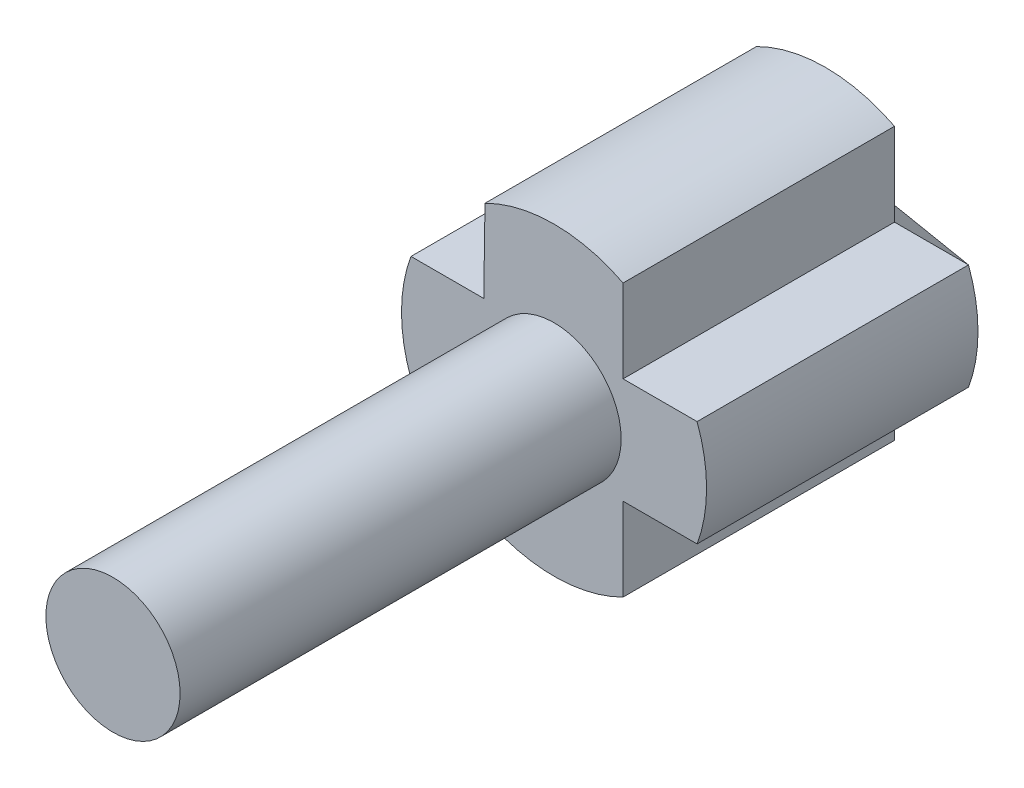
from build123d import *

# Parameters (mm, degrees)
SKETCH_1_R      = 19.783013461
EXTRUDE_1_DEPTH = 130
EXTRUDE_2_DEPTH = 80


with BuildPart() as part:
    # 草图1 → 凸台-拉伸1 (new body)
    with BuildSketch(Plane.XY):
        Circle(SKETCH_1_R)
    extrude(amount=EXTRUDE_1_DEPTH)

    # 草图2 → 凸台-拉伸2 (add)
    with BuildSketch(Plane(origin=(0, 0, 0), x_dir=(-1, 0, 0), z_dir=(0, 0, -1))):
        with BuildLine():
            Line((-20.351449461, 40.092355437), (-20.351449461, 15.61573037))
            Line((-20.351449461, 15.61573037), (-42.163105017, 15.61573037))
            ThreePointArc((-42.163105017, 15.61573037), (-44.961966813, 0), (-42.163105017, -15.61573037))
            Line((-42.163105017, -15.61573037), (-20.351449461, -15.61573037))
            Line((-20.351449461, -15.61573037), (-20.351449461, -40.092355437))
            ThreePointArc((-20.351449461, -40.092355437), (0.671443732, -44.956952999), (21.539684559, -39.466700505))
            Line((21.539684559, -39.466700505), (21.183464145, -15.61573037))
            Line((21.183464145, -15.61573037), (42.163105017, -15.61573037))
            ThreePointArc((42.163105017, -15.61573037), (44.961966813, 0), (42.163105017, 15.61573037))
            Line((42.163105017, 15.61573037), (20.717014193, 15.61573037))
            Line((20.717014193, 15.61573037), (20.351449461, 40.092355437))
            ThreePointArc((20.351449461, 40.092355437), (0, 44.961966813), (-20.351449461, 40.092355437))
        make_face()
    extrude(amount=EXTRUDE_2_DEPTH)

    # 草图4 → 放样1 section 0
    with BuildSketch(Plane(origin=(0, 0, -80), x_dir=(-1, 0, 0), z_dir=(0, 0, -1)), mode=Mode.PRIVATE) as loft_1_s0:
        with BuildLine():
            Line((-20.351449461, 15.61573037), (-42.163105017, 15.61573037))
            ThreePointArc((-42.163105017, 15.61573037), (-44.961966813, 0), (-42.163105017, -15.61573037))
            Line((-42.163105017, -15.61573037), (-20.351449461, -15.61573037))
            Line((-20.351449461, -15.61573037), (-20.351449461, -40.092355437))
            ThreePointArc((-20.351449461, -40.092355437), (0.671443732, -44.956952999), (21.539684559, -39.466700505))
            Line((21.539684559, -39.466700505), (21.183464145, -15.61573037))
            Line((21.183464145, -15.61573037), (42.163105017, -15.61573037))
            ThreePointArc((42.163105017, -15.61573037), (44.961966813, 0), (42.163105017, 15.61573037))
            Line((42.163105017, 15.61573037), (20.717014193, 15.61573037))
            Line((20.717014193, 15.61573037), (20.351449461, 40.092355437))
            ThreePointArc((20.351449461, 40.092355437), (0, 44.961966813), (-20.351449461, 40.092355437))
            Line((-20.351449461, 40.092355437), (-20.351449461, 15.61573037))
        make_face()
    loft([loft_1_s0.sketch, Vertex(0, 0, -100)])


solid = part.part
